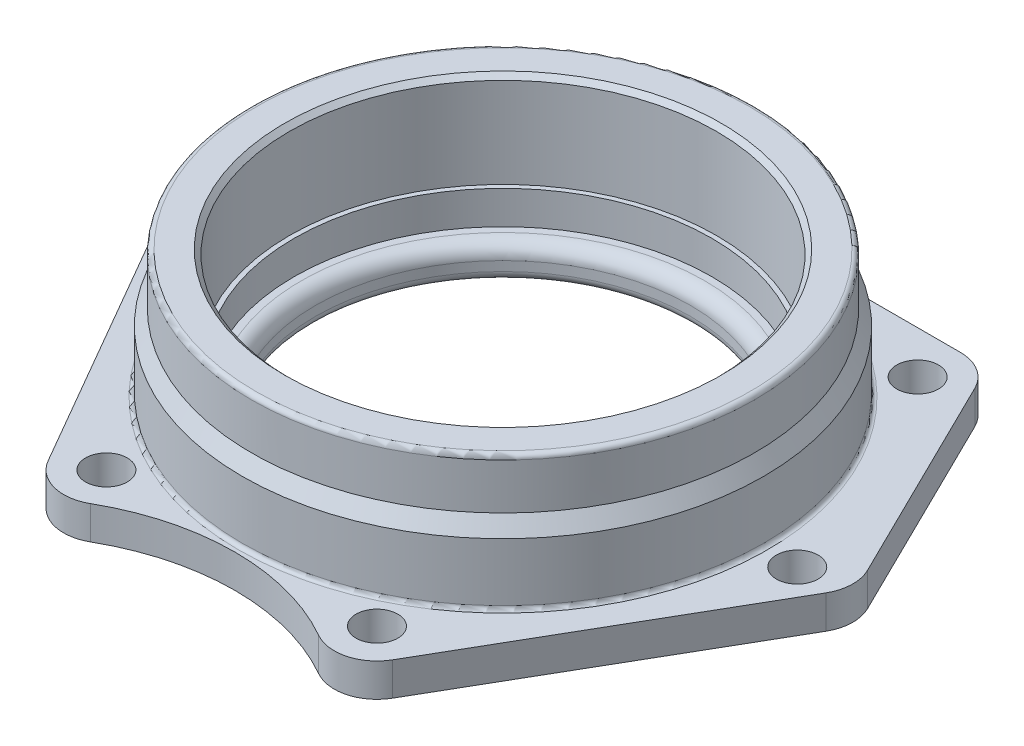
from build123d import *

# Parameters (mm, degrees)
BOSS_EXTRUDE1_DEPTH        = 7
SKETCH5_R                  = 45
CUT_EXTRUDE1_DEPTH         = 20
SKETCH6_R                  = 44
CUT_EXTRUDE3_DEPTH         = 7
SKETCH8_R                  = 39.5
CUT_EXTRUDE4_DEPTH         = 7
F_8_8_8_8_DIAMETER_HOLE1_D = 8.8
CHAMFER1_SIZE              = 1
FILLET1_R                  = 1
FILLET3_R                  = 2
FILLET4_R                  = 0.8
FILLET5_R                  = 3
BOSS_EXTRUDE2_DEPTH        = 1


with BuildPart() as part:
    # Sketch1 → Boss-Extrude1 (new body)
    with BuildSketch(Plane(origin=(0, 0, 0), x_dir=(1, 0, 0), z_dir=(0, 1, 0))):
        with BuildLine():
            Line((-40.001844064, 56.369319939), (40.001844064, 56.369319939))
            ThreePointArc((40.001844064, 56.369319939), (44.757455682, 55.010272637), (48.076822603, 51.343577304))
            Line((48.076822603, 51.343577304), (70.011643797, 6.775952684))
            ThreePointArc((70.011643797, 6.775952684), (70.931678065, 2.502121267), (69.729322621, -1.701025105))
            Line((69.729322621, -1.701025105), (36.296218849, -59.56220628))
            ThreePointArc((36.296218849, -59.56220628), (30.85289019, -63.747446182), (24.042134471, -62.875857711))
            ThreePointArc((24.042134471, -62.875857711), (0, -56.497417156), (-24.042134471, -62.875857711))
            ThreePointArc((-24.042134471, -62.875857711), (-30.85289019, -63.747446182), (-36.296218849, -59.56220628))
            Line((-36.296218849, -59.56220628), (-69.729322621, -1.701025105))
            ThreePointArc((-69.729322621, -1.701025105), (-70.931678065, 2.502121267), (-70.011643797, 6.775952684))
            Line((-70.011643797, 6.775952684), (-48.076822603, 51.343577304))
            ThreePointArc((-48.076822603, 51.343577304), (-44.757455682, 55.010272637), (-40.001844064, 56.369319939))
        make_face()
    extrude(amount=BOSS_EXTRUDE1_DEPTH)

    # Sketch4 → Revolve2 (revolve)
    with BuildSketch(Plane(origin=(0, 0, 0), x_dir=(0, 0, -1), z_dir=(1, 0, 0))):
        Polygon((0, 0), (0, 34), (53, 34), (53, 23.333628962), (54.924671579, 20), (54.924671579, 0), align=None)
    revolve(axis=Axis((0, 0, 0), (0, 1, 0)))

    # Sketch5 → Cut-Extrude1 (cut)
    with BuildSketch(Plane(origin=(0, 34, 0), x_dir=(1, 0, 0), z_dir=(0, 1, 0))):
        with Locations(Location((0, 0, 0), (0, 0, 270))):
            Circle(SKETCH5_R)
    extrude(amount=-CUT_EXTRUDE1_DEPTH, mode=Mode.SUBTRACT)

    # Sketch6 → Cut-Extrude3 (cut)
    with BuildSketch(Plane(origin=(0, 14, 0), x_dir=(1, 0, 0), z_dir=(0, 1, 0))):
        with Locations(Location((0, 0, 0), (0, 0, 270))):
            Circle(SKETCH6_R)
    extrude(amount=-CUT_EXTRUDE3_DEPTH, mode=Mode.SUBTRACT)

    # Sketch8 → Cut-Extrude4 (cut)
    with BuildSketch(Plane(origin=(0, 7, 0), x_dir=(1, 0, 0), z_dir=(0, 1, 0))):
        with Locations(Location((0, 0, 0), (0, 0, 270))):
            Circle(SKETCH8_R)
    extrude(amount=-CUT_EXTRUDE4_DEPTH, mode=Mode.SUBTRACT)

    # Ø8.8 (8.8) Diameter Hole1 (through all)
    with Locations(Plane(origin=(0, 7, 0), x_dir=(1, 0, 0), z_dir=(0, 1, 0))):
        with Locations((-62, 0), (62, 0), (28.503561486, -55.059485855), (-28.503561486, -55.059485855), (-40.001844064, 47.369319939), (40.001844064, 47.369319939)):
            Hole(F_8_8_8_8_DIAMETER_HOLE1_D / 2)

    # Chamfer1
    chamfer1_edges = [part.edges().sort_by_distance(p)[0] for p in [
        (0, 34, -45),
    ]]
    chamfer(chamfer1_edges, length=CHAMFER1_SIZE)

    # Fillet1
    fillet1_edges = [part.edges().sort_by_distance(p)[0] for p in [
        (0, 34, 53),
    ]]
    fillet(fillet1_edges, radius=FILLET1_R)

    # Fillet3
    fillet3_edges = [part.edges().sort_by_distance(p)[0] for p in [
        (0, 0, -39.5),
    ]]
    fillet(fillet3_edges, radius=FILLET3_R)

    # Fillet4
    fillet4_edges = [part.edges().sort_by_distance(p)[0] for p in [
        (0, 7, 54.924671579),
    ]]
    fillet(fillet4_edges, radius=FILLET4_R)

    # Fillet5
    fillet5_edges = [part.edges().sort_by_distance(p)[0] for p in [
        (0, 7, -39.5),
    ]]
    fillet(fillet5_edges, radius=FILLET5_R)

    # Sketch14 → Boss-Extrude2 (add)
    # profile 1 of 6: a face of its own
    with BuildSketch(Plane.XZ):
        Polygon((-49.543668777, -15.701397917), (-52.160255315, -18.505885097), (-52.299778552, -18.160232052), (-51.443708841, -17.225636699), (-52.004606277, -15.836013302), (-53.268728873, -15.76099327), (-53.413861085, -15.401317789), (-49.575920379, -15.622171154), align=None)
        Polygon((-50.243388328, -15.937675962), (-51.635115091, -15.855644712), (-51.190603873, -16.957808174), align=None, mode=Mode.SUBTRACT)
    # profile 2 of 6: a face of its own
    with BuildSketch(Plane.XZ):
        with BuildLine():
            Line((-51.952551008, -19.013684924), (-48.729494117, -17.711701751))
            Line((-48.729494117, -17.711701751), (-48.459562226, -18.380571943))
            add(Edge.make_bspline(
                [(-48.459562226, -18.380571943), (-48.436319484, -18.438869332), (-48.391527252, -18.551217098), (-48.332197088, -18.715837983), (-48.279869356, -18.868901378), (-48.236746224, -19.011472904), (-48.203016387, -19.143227311), (-48.177589166, -19.263893851), (-48.159744735, -19.37360661), (-48.15480571, -19.443421596), (-48.15247088, -19.476425309)],
                knots=[0, 0, 0, 0, 1.318128298, 2.540229846, 3.674976834, 4.715486728, 5.667951583, 6.530565877, 7.305352836, 8, 8, 8, 8], degree=3))
            add(Edge.make_bspline(
                [(-48.15247088, -19.476425309), (-48.151224452, -19.520606977), (-48.148768191, -19.607673125), (-48.158604762, -19.736863905), (-48.177290489, -19.862545907), (-48.20614634, -19.985268532), (-48.245237679, -20.104583309), (-48.295722785, -20.220129151), (-48.355312524, -20.33252403), (-48.42475478, -20.441047803), (-48.503132327, -20.544811018), (-48.590432451, -20.642263928), (-48.685411525, -20.734142298), (-48.78945408, -20.81872348), (-48.901448884, -20.897257962), (-49.020847396, -20.970773883), (-49.149325985, -21.036528429), (-49.239194617, -21.074600395), (-49.284782579, -21.093913289)],
                knots=[0, 0, 0, 0, 1.002436367, 1.975440866, 2.935524168, 3.883623185, 4.832893364, 5.780695656, 6.741584304, 7.7170141, 8.701371253, 9.689279608, 10.683262391, 11.697138007, 12.728616468, 13.785564042, 14.876675657, 16, 16, 16, 16], degree=3))
            add(Edge.make_bspline(
                [(-49.284782579, -21.093913289), (-49.324815131, -21.109331789), (-49.403899502, -21.139791059), (-49.523778301, -21.176870412), (-49.642767374, -21.205680865), (-49.760487205, -21.227015821), (-49.877418114, -21.239561485), (-49.993338957, -21.244479251), (-50.108405872, -21.242004451), (-50.221706432, -21.23038608), (-50.332343223, -21.212575154), (-50.438930962, -21.186883076), (-50.541509718, -21.156494998), (-50.639349049, -21.118977336), (-50.732988708, -21.075859162), (-50.821324957, -21.024799667), (-50.905855004, -20.968661326), (-50.986930076, -20.905886064), (-51.063640011, -20.833392499), (-51.138502103, -20.751644166), (-51.210394991, -20.658684386), (-51.280555312, -20.555374378), (-51.34830296, -20.441286466), (-51.415042693, -20.317333909), (-51.478782823, -20.182378875), (-51.518013915, -20.087973122), (-51.538188027, -20.03942611)],
                knots=[0, 0, 0, 0, 1.089389366, 2.15209041, 3.184381895, 4.197412583, 5.188571916, 6.168900145, 7.142700834, 8.10901874, 9.05952745, 9.986767119, 10.891931066, 11.774986155, 12.646048741, 13.5074912, 14.363599599, 15.222112427, 16.108254607, 17.041026014, 18.034901271, 19.09026574, 20.211109633, 21.403560202, 22.66481235, 24, 24, 24, 24], degree=3))
            Line((-51.538188027, -20.03942611), (-51.952551008, -19.013684924))
        make_face()
        with BuildLine():
            Line((-51.52346447, -19.200183321), (-51.373424406, -19.572478994))
            add(Edge.make_bspline(
                [(-51.373424406, -19.572478994), (-51.351687068, -19.625861431), (-51.309857596, -19.728586024), (-51.245995509, -19.874794681), (-51.185358504, -20.007631691), (-51.126477819, -20.126080253), (-51.070447188, -20.230898537), (-51.017349895, -20.321989806), (-50.967611746, -20.400034109), (-50.93205766, -20.444920434), (-50.915591873, -20.465708161)],
                knots=[0, 0, 0, 0, 1.373973852, 2.643957675, 3.803132799, 4.854571426, 5.796777433, 6.63573208, 7.368181077, 8, 8, 8, 8], degree=3))
            add(Edge.make_bspline(
                [(-50.915591873, -20.465708161), (-50.893067449, -20.491076278), (-50.848579246, -20.541181086), (-50.775849059, -20.609380616), (-50.699586198, -20.670612056), (-50.618798321, -20.723974157), (-50.534992901, -20.77166449), (-50.445875983, -20.809543603), (-50.353897644, -20.842519476), (-50.257820072, -20.866646744), (-50.159162967, -20.883695793), (-50.058287851, -20.891826428), (-49.955849846, -20.892723152), (-49.851758396, -20.884830378), (-49.746062391, -20.868565655), (-49.638926588, -20.843633305), (-49.529789733, -20.811760922), (-49.458011128, -20.784076534), (-49.421501329, -20.76999502)],
                knots=[0, 0, 0, 0, 0.99342231, 1.962117752, 2.916971191, 3.85503458, 4.796016756, 5.737297783, 6.687895217, 7.65600979, 8.6352695, 9.617778921, 10.617410475, 11.633506781, 12.672504164, 13.747098093, 14.854073601, 16, 16, 16, 16], degree=3))
            add(Edge.make_bspline(
                [(-49.421501329, -20.76999502), (-49.383641237, -20.753905877), (-49.308922936, -20.722153354), (-49.202690032, -20.666608393), (-49.103129906, -20.606294537), (-49.011211685, -20.540174357), (-48.925893295, -20.469227129), (-48.847683766, -20.392838655), (-48.777686199, -20.31009173), (-48.713598524, -20.223688802), (-48.658266213, -20.132259656), (-48.61120855, -20.037798765), (-48.573086878, -19.940158697), (-48.543431996, -19.83982122), (-48.523320599, -19.736256133), (-48.511213396, -19.629838407), (-48.508367186, -19.52050369), (-48.513207587, -19.446958665), (-48.51565197, -19.409818738)],
                knots=[0, 0, 0, 0, 1.120915847, 2.212169129, 3.264268614, 4.2913861, 5.295427879, 6.286451793, 7.266916285, 8.246718328, 9.215775873, 10.175851217, 11.119857042, 12.069285214, 13.023764875, 13.991753987, 14.985844258, 16, 16, 16, 16], degree=3))
            add(Edge.make_bspline(
                [(-48.51565197, -19.409818738), (-48.518947599, -19.379603205), (-48.525987362, -19.31506008), (-48.546867029, -19.213757546), (-48.573321082, -19.100883292), (-48.608745038, -18.97730872), (-48.651786281, -18.842498512), (-48.70224613, -18.6965188), (-48.761515015, -18.539743047), (-48.804141475, -18.431699133), (-48.826248925, -18.375664091)],
                knots=[0, 0, 0, 0, 0.673256086, 1.438136185, 2.289883846, 3.242504658, 4.285922505, 5.425944978, 6.665012424, 8, 8, 8, 8], degree=3))
            Line((-48.826248925, -18.375664091), (-48.91809588, -18.147799507))
            Line((-48.91809588, -18.147799507), (-51.52346447, -19.200183321))
        make_face(mode=Mode.SUBTRACT)
    # profile 3 of 6: a face of its own
    with BuildSketch(Plane.XZ):
        Polygon((-47.401397182, -20.99384052), (-47.27168965, -21.315655424), (-50.494746541, -22.617638597), (-50.624454073, -22.295823693), align=None)
    # profile 4 of 6: a face of its own
    with BuildSketch(Plane.XZ):
        Polygon((-47.421678037, -21.844918449), (-47.108276595, -21.718015405), (-46.394534607, -23.486244571), (-46.70793605, -23.613147616), (-46.998200473, -22.894497776), (-49.907855922, -24.069577905), (-50.040367941, -23.740751783), (-47.130712492, -22.565671655), align=None)
    # profile 5 of 6: a face of its own
    with BuildSketch(Plane.XZ):
        Polygon((-46.307496458, -23.697355073), (-46.157456394, -24.069650746), (-47.152348221, -25.429827028), (-45.497700785, -25.70396565), (-45.346959599, -26.076962445), (-47.441911522, -25.735516131), (-48.982276105, -26.357411163), (-49.110581394, -26.039802989), (-47.57021681, -25.417907957), align=None)
    # profile 6 of 6: a face of its own
    with BuildSketch(Plane.XZ):
        Polygon((-44.595920352, -27.930738364), (-47.21250689, -30.735225544), (-47.352030127, -30.389572499), (-46.495960416, -29.454977146), (-47.056857852, -28.065353749), (-48.320980448, -27.990333717), (-48.466112659, -27.630658236), (-44.628171954, -27.851511601), align=None)
        Polygon((-45.295639903, -28.167016409), (-46.687366666, -28.084985159), (-46.242855448, -29.187148621), align=None, mode=Mode.SUBTRACT)
    extrude(amount=BOSS_EXTRUDE2_DEPTH)


solid = part.part
